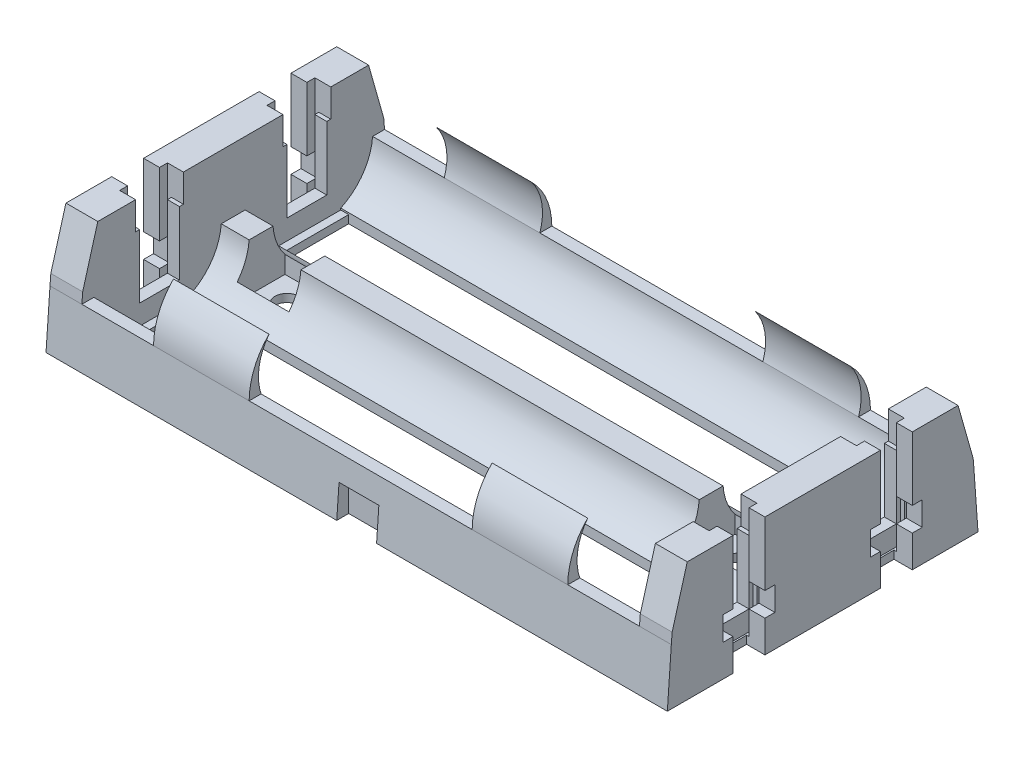
from build123d import *

# Parameters (mm, degrees)
SKETCH1_W            = 78
SKETCH1_H            = 39
BOSS_EXTRUDE1_DEPTH  = 7
CUT_EXTRUDE1_DEPTH   = 81.704708661
SKETCH3_W            = 70
SKETCH3_H            = 8
CUT_EXTRUDE2_DEPTH   = 6
CUT_EXTRUDE3_DEPTH   = 70
MIRROR9_COPY_1_DEPTH = 70
MIRROR9_COPY_2_DEPTH = 70
SKETCH5_W            = 68
SKETCH5_H            = 8
CUT_EXTRUDE4_DEPTH   = 45.014202253
BOSS_EXTRUDE2_DEPTH  = 12
MIRROR3_COPY_1_DEPTH = 12
BOSS_EXTRUDE3_DEPTH  = 4
SKETCH9_W            = 6.5
SKETCH9_H            = 3
CUT_EXTRUDE5_DEPTH   = 2
CUT_EXTRUDE6_DEPTH   = 2
SKETCH12_W           = 0.5
SKETCH12_H           = 6
CUT_EXTRUDE11_DEPTH  = 10.5
SKETCH13_W           = 4.001855858
SKETCH13_H           = 15
CUT_EXTRUDE9_DEPTH   = 2.3
SKETCH14_W           = 5
SKETCH14_H           = 1.5
CUT_EXTRUDE10_DEPTH  = 4
SKETCH15_W           = 6.5
SKETCH15_H           = 6
CUT_EXTRUDE12_DEPTH  = 6
CUT_EXTRUDE13_REACH  = 47.796
SKETCH16_R           = 1.5


with BuildPart() as part:
    # Sketch1 → Boss-Extrude1 (new body)
    with BuildSketch(Plane(origin=(0, 0, 0), x_dir=(1, 0, 0), z_dir=(0, 1, 0))):
        Rectangle(SKETCH1_W, SKETCH1_H)
    extrude(amount=BOSS_EXTRUDE1_DEPTH)

    # Sketch2 → Cut-Extrude1 (cut, through all)
    with BuildSketch(Plane(origin=(39, 0, 0), x_dir=(0, 0, -1), z_dir=(1, 0, 0))):
        Polygon((19, 7), (19.5, 0), (19.5, 7), align=None)
        Polygon((-19, 7), (-19.5, 0), (-19.5, 7), align=None)
    extrude(amount=-CUT_EXTRUDE1_DEPTH, mode=Mode.SUBTRACT)

    # Sketch3 → Cut-Extrude2 (cut)
    with BuildSketch(Plane(origin=(0, 7, 0), x_dir=(1, 0, 0), z_dir=(0, 1, 0))):
        with Locations((0, -9.5)):
            Rectangle(SKETCH3_W, SKETCH3_H)
        with Locations((0, 9.5)):
            Rectangle(SKETCH3_W, SKETCH3_H)
    extrude(amount=-CUT_EXTRUDE2_DEPTH, mode=Mode.SUBTRACT)

    # Sketch4 → Cut-Extrude3 (cut)
    with BuildSketch(Plane(origin=(35, 0, 0), x_dir=(0, 0, -1), z_dir=(1, 0, 0))):
        with BuildLine():
            Line((13, 1), (13, 7))
            Line((13, 7), (17.5, 7))
            ThreePointArc((17.5, 7), (16.132310367, 3.338267225), (13, 1))
        make_face()
    cut_extrude3 = extrude(amount=-CUT_EXTRUDE3_DEPTH, mode=Mode.SUBTRACT)

    # Mirror1: Cut-Extrude3 across plane
    add(cut_extrude3.mirror(Plane.XY), mode=Mode.SUBTRACT)

    # Mirror8: Cut-Extrude3 across plane
    add(cut_extrude3.mirror(Plane.XY.offset(-9.5)), mode=Mode.SUBTRACT)

    # Mirror9 copy 1 sketch → Mirror9 copy 1 (cut)
    with BuildSketch(Plane(origin=(35, 0, 19), x_dir=(0, 0, -1), z_dir=(1, 0, 0))):
        with BuildLine():
            Line((13, 1), (13, 7))
            Line((13, 7), (17.5, 7))
            ThreePointArc((17.5, 7), (16.132310367, 3.338267225), (13, 1))
        make_face()
    extrude(amount=-MIRROR9_COPY_1_DEPTH, mode=Mode.SUBTRACT)

    # Mirror9 copy 2 sketch → Mirror9 copy 2 (cut)
    with BuildSketch(Plane(origin=(35, 0, 19), x_dir=(0, 0, 1), z_dir=(1, 0, 0))):
        with BuildLine():
            Line((13, -1), (13, -7))
            Line((13, -7), (17.5, -7))
            ThreePointArc((17.5, -7), (16.132310367, -3.338267225), (13, -1))
        make_face()
    extrude(amount=-MIRROR9_COPY_2_DEPTH, mode=Mode.SUBTRACT)

    # Sketch5 → Cut-Extrude4 (cut, through all)
    with BuildSketch(Plane(origin=(0, 1, 0), x_dir=(1, 0, 0), z_dir=(0, 1, 0))):
        with Locations((0, 9.5)):
            Rectangle(SKETCH5_W, SKETCH5_H)
        with Locations((0, -9.5)):
            Rectangle(SKETCH5_W, SKETCH5_H)
    extrude(amount=-CUT_EXTRUDE4_DEPTH, mode=Mode.SUBTRACT)

    # Sketch6 → Boss-Extrude2 (add)
    with BuildSketch(Plane(origin=(26, 0, 0), x_dir=(0, 0, -1), z_dir=(1, 0, 0))):
        with BuildLine():
            Line((-19, 7), (-17.5, 7))
            ThreePointArc((-17.5, 7), (-17.740958247, 10.123493041), (-16.5, 13))
            ThreePointArc((-16.5, 13), (-18.343954985, 10.247481244), (-19, 7))
        make_face()
    boss_extrude2 = extrude(amount=-BOSS_EXTRUDE2_DEPTH)

    # Mirror2: Boss-Extrude2 across plane
    add(boss_extrude2.mirror(Plane(origin=(0, 0, 0), x_dir=(0, 0, 1), z_dir=(1, 0, 0))))

    # Mirror3: Boss-Extrude2 across plane
    add(boss_extrude2.mirror(Plane.XY))

    # Mirror3 copy 1 sketch → Mirror3 copy 1 (add)
    with BuildSketch(Plane.ZY.offset(26)):
        with BuildLine():
            Line((-19, 7), (-17.5, 7))
            ThreePointArc((-17.5, 7), (-17.740958247, 10.123493041), (-16.5, 13))
            ThreePointArc((-16.5, 13), (-18.343954985, 10.247481244), (-19, 7))
        make_face()
    extrude(amount=-MIRROR3_COPY_1_DEPTH)

    # Sketch8 → Boss-Extrude3 (add)
    with BuildSketch(Plane(origin=(39, 0, 0), x_dir=(0, 0, -1), z_dir=(1, 0, 0))):
        Polygon((-17, 15), (17, 15), (18.894572253, 8.304261216), (19, 7), (-19, 7), (-18.894572253, 8.304261216), align=None)
    boss_extrude3 = extrude(amount=-BOSS_EXTRUDE3_DEPTH)

    # Mirror4: Boss-Extrude3 across plane
    add(boss_extrude3.mirror(Plane(origin=(0, 0, 0), x_dir=(0, 0, 1), z_dir=(1, 0, 0))))

    # Sketch9 → Cut-Extrude5 (cut)
    with BuildSketch(Plane(origin=(39, 0, 0), x_dir=(0, 0, -1), z_dir=(1, 0, 0))):
        with Locations((9.25, 5.5)):
            Rectangle(SKETCH9_W, SKETCH9_H)
        with Locations((-9.25, 5.5)):
            Rectangle(SKETCH9_W, SKETCH9_H)
    cut_extrude5 = extrude(amount=-CUT_EXTRUDE5_DEPTH, mode=Mode.SUBTRACT)

    # Mirror5: Cut-Extrude5 across plane
    add(cut_extrude5.mirror(Plane(origin=(0, 0, 0), x_dir=(0, 0, 1), z_dir=(1, 0, 0))), mode=Mode.SUBTRACT)

    # Sketch11 → Cut-Extrude6 (cut)
    with BuildSketch(Plane.ZY.offset(-35)):
        Polygon((6.75, 3.5), (11.75, 3.5), (11.75, 11.5), (12.25, 11.5), (12.25, 15), (6.25, 15), (6.25, 11.5), (6.75, 11.5), align=None)
        Polygon((-6.75, 11.5), (-6.25, 11.5), (-6.25, 15), (-12.25, 15), (-12.25, 11.5), (-11.75, 11.5), (-11.75, 3.5), (-6.75, 3.5), align=None)
    cut_extrude6 = extrude(amount=-CUT_EXTRUDE6_DEPTH, mode=Mode.SUBTRACT)

    # Sketch12 → Cut-Extrude11 (cut)
    with BuildSketch(Plane(origin=(0, 11.5, 0), x_dir=(1, 0, 0), z_dir=(0, 1, 0))):
        with Locations((36.75, 9.25)):
            Rectangle(SKETCH12_W, SKETCH12_H)
        with Locations((36.75, -9.25)):
            Rectangle(SKETCH12_W, SKETCH12_H)
    cut_extrude11 = extrude(amount=-CUT_EXTRUDE11_DEPTH, mode=Mode.SUBTRACT)

    # Sketch13 → Cut-Extrude9 (cut)
    with BuildSketch(Plane(origin=(39, 0, 0), x_dir=(0, 0, -1), z_dir=(1, 0, 0))):
        with Locations((9.25, 7.5)):
            Rectangle(SKETCH13_W, SKETCH13_H)
        with Locations((-9.25, 7.5)):
            Rectangle(SKETCH13_W, SKETCH13_H)
    cut_extrude9 = extrude(amount=-CUT_EXTRUDE9_DEPTH, mode=Mode.SUBTRACT)

    # Mirror10: Cut-Extrude6, Cut-Extrude11, Cut-Extrude9 across plane
    add(cut_extrude6.mirror(Plane(origin=(0, 0, 0), x_dir=(0, 0, 1), z_dir=(1, 0, 0))), mode=Mode.SUBTRACT)
    add(cut_extrude11.mirror(Plane(origin=(0, 0, 0), x_dir=(0, 0, 1), z_dir=(1, 0, 0))), mode=Mode.SUBTRACT)
    add(cut_extrude9.mirror(Plane(origin=(0, 0, 0), x_dir=(0, 0, 1), z_dir=(1, 0, 0))), mode=Mode.SUBTRACT)

    # Sketch14 → Cut-Extrude10 (cut)
    with BuildSketch(Plane.XZ):
        with Locations((0, 18.75)):
            Rectangle(SKETCH14_W, SKETCH14_H)
    cut_extrude10 = extrude(amount=-CUT_EXTRUDE10_DEPTH, mode=Mode.SUBTRACT)

    # Mirror7: Cut-Extrude10 across plane
    add(cut_extrude10.mirror(Plane.XY), mode=Mode.SUBTRACT)

    # Sketch15 → Cut-Extrude12 (cut)
    with BuildSketch(Plane(origin=(0, 7, 0), x_dir=(1, 0, 0), z_dir=(0, 1, 0))):
        with Locations((-28.25, 0)):
            Rectangle(SKETCH15_W, SKETCH15_H)
        with Locations((28.25, 0)):
            Rectangle(SKETCH15_W, SKETCH15_H)
    extrude(amount=-CUT_EXTRUDE12_DEPTH, mode=Mode.SUBTRACT)

    # Sketch16 → Cut-Extrude13 (cut, up to next)
    with BuildSketch(Plane(origin=(0, 1, 0), x_dir=(1, 0, 0), z_dir=(0, 1, 0)), mode=Mode.PRIVATE) as cut_extrude13_sk1:
        with Locations(Location((-28.25, 0, 0), (0, 0, 270))):
            Circle(SKETCH16_R)
    cut_extrude13_tool1 = extrude(cut_extrude13_sk1.sketch, amount=-CUT_EXTRUDE13_REACH, mode=Mode.PRIVATE) & part.part
    # Sketch16 → Cut-Extrude13 (cut, up to next)
    with BuildSketch(Plane(origin=(0, 1, 0), x_dir=(1, 0, 0), z_dir=(0, 1, 0)), mode=Mode.PRIVATE) as cut_extrude13_sk2:
        with Locations(Location((28.25, 0, 0), (0, 0, 270))):
            Circle(SKETCH16_R)
    cut_extrude13_tool2 = extrude(cut_extrude13_sk2.sketch, amount=-CUT_EXTRUDE13_REACH, mode=Mode.PRIVATE) & part.part
    add(cut_extrude13_tool1.solids().sort_by_distance((-28.25, 1, 0))[0], mode=Mode.SUBTRACT)
    add(cut_extrude13_tool2.solids().sort_by_distance((28.25, 1, 0))[0], mode=Mode.SUBTRACT)


solid = part.part
